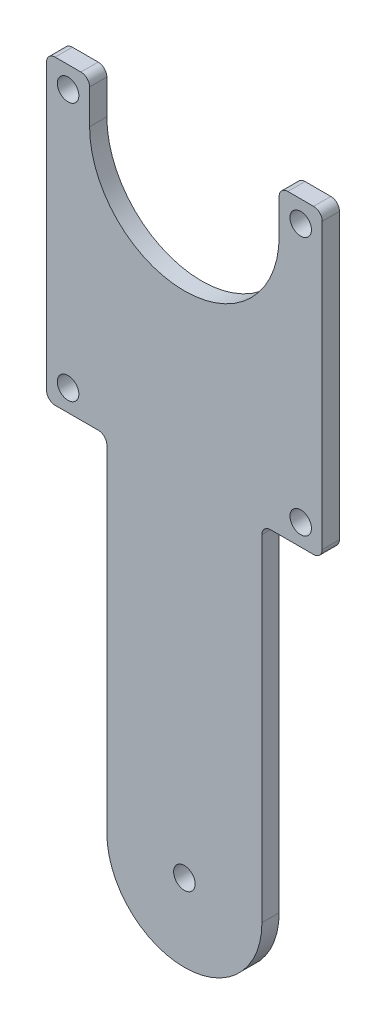
from build123d import *

# Parameters (mm, degrees)
SKETCH_1_R      = 1.25
EXTRUDE_1_DEPTH = 2


with BuildPart() as part:
    # 草圖1 → 填料-伸長1 (new body)
    with BuildSketch(Plane.XY):
        with BuildLine():
            Line((18.048613933, -20.404186252), (23.048613933, -20.404186252))
            ThreePointArc((23.048613933, -20.404186252), (23.755720714, -20.111293033), (24.048613933, -19.404186252))
            Line((24.048613933, -19.404186252), (24.048613933, -15.404186252))
            Line((24.048613933, -15.404186252), (24.048613933, -2.404186252))
            Line((24.048613933, -2.404186252), (24.048613933, 13.595813748))
            ThreePointArc((24.048613933, 13.595813748), (23.755720714, 14.302920529), (23.048613933, 14.595813748))
            Line((23.048613933, 14.595813748), (20.048613933, 14.595813748))
            ThreePointArc((20.048613933, 14.595813748), (19.341507152, 14.302920529), (19.048613933, 13.595813748))
            Line((19.048613933, 13.595813748), (19.048613933, 9.595813748))
            ThreePointArc((19.048613933, 9.595813748), (8.048613933, -1.404186252), (-2.951386067, 9.595813748))
            Line((-2.951386067, 9.595813748), (-2.951386067, 13.595813748))
            ThreePointArc((-2.951386067, 13.595813748), (-3.244279286, 14.302920529), (-3.951386067, 14.595813748))
            Line((-3.951386067, 14.595813748), (-6.951386067, 14.595813748))
            ThreePointArc((-6.951386067, 14.595813748), (-7.658492848, 14.302920529), (-7.951386067, 13.595813748))
            Line((-7.951386067, 13.595813748), (-7.951386067, -2.404186252))
            Line((-7.951386067, -2.404186252), (-7.951386067, -15.404186252))
            Line((-7.951386067, -15.404186252), (-7.951386067, -19.404186252))
            ThreePointArc((-7.951386067, -19.404186252), (-7.658492848, -20.111293033), (-6.951386067, -20.404186252))
            Line((-6.951386067, -20.404186252), (-1.951386067, -20.404186252))
            ThreePointArc((-1.951386067, -20.404186252), (-1.244279286, -20.697079471), (-0.951386067, -21.404186252))
            Line((-0.951386067, -21.404186252), (-0.951386067, -60.404186252))
            ThreePointArc((-0.951386067, -60.404186252), (8.048613933, -69.404186252), (17.048613933, -60.404186252))
            Line((17.048613933, -60.404186252), (17.048613933, -21.404186252))
            ThreePointArc((17.048613933, -21.404186252), (17.341507152, -20.697079471), (18.048613933, -20.404186252))
        make_face()
        with Locations((8.048613933, -60.404186252)):
            Circle(SKETCH_1_R, mode=Mode.SUBTRACT)
        with Locations((-5.451386067, -17.904186252)):
            Circle(SKETCH_1_R, mode=Mode.SUBTRACT)
        with Locations((-5.451386067, 12.095813748)):
            Circle(SKETCH_1_R, mode=Mode.SUBTRACT)
        with Locations((21.548613933, -17.904186252)):
            Circle(SKETCH_1_R, mode=Mode.SUBTRACT)
        with Locations((21.548613933, 12.095813748)):
            Circle(SKETCH_1_R, mode=Mode.SUBTRACT)
    extrude(amount=EXTRUDE_1_DEPTH)


solid = part.part
